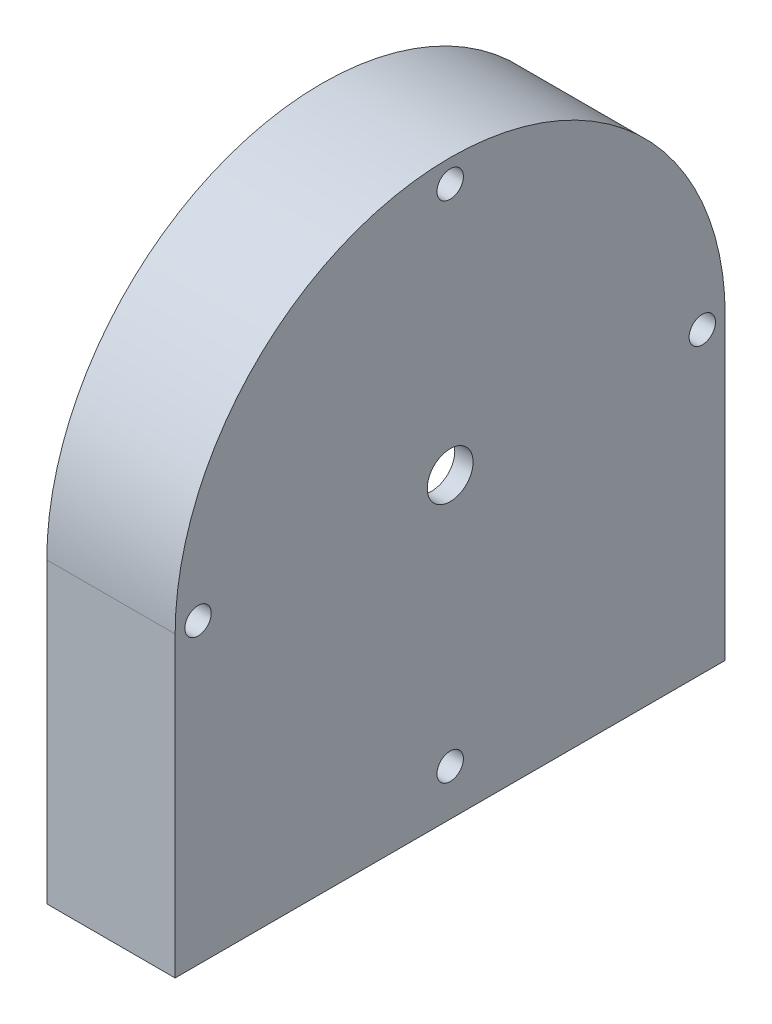
from build123d import *

# Parameters (mm, degrees)
SKETCH1_R                 = 38.1
BOSS_EXTRUDE1_DEPTH       = 17.78
SKETCH2_R                 = 25.4
CUT_EXTRUDE1_DEPTH        = 8.89
F_6_CLEARANCE_HOLE1_D     = 3.6576
SKETCH6_R                 = 14.2875
CUT_EXTRUDE2_DEPTH        = 6.35
SKETCH7_R                 = 3.175
CUT_EXTRUDE3_DEPTH        = 59.918282604
F_6_CLEARANCE_HOLE2_D     = 3.6576
F_6_CLEARANCE_HOLE2_DEPTH = 12.7
F_6_CLEARANCE_HOLE2_TIP   = 1.0988539


with BuildPart() as part:
    # Sketch1 → Boss-Extrude1 (new body)
    with BuildSketch(Plane(origin=(0, 0, 0), x_dir=(0, 0, -1), z_dir=(1, 0, 0))):
        with BuildLine():
            ThreePointArc((38.1, 0), (0, -38.1), (-38.1, 0))
            Line((-38.1, 0), (-38.1, -41.275))
            Line((-38.1, -41.275), (38.1, -41.275))
            Line((38.1, -41.275), (38.1, 0))
        make_face()
        Circle(SKETCH1_R)
    extrude(amount=BOSS_EXTRUDE1_DEPTH)

    # Sketch2 → Cut-Extrude1 (cut)
    with BuildSketch(Plane.ZY):
        Circle(SKETCH2_R)
    extrude(amount=-CUT_EXTRUDE1_DEPTH, mode=Mode.SUBTRACT)

    # #6 Clearance Hole1 (through all)
    with Locations(Plane(origin=(17.78, 0, 0), x_dir=(0, 0, -1), z_dir=(1, 0, 0))):
        with Locations((0, 34.925), (34.925, 0), (0, -34.925), (-34.925, 0)):
            Hole(F_6_CLEARANCE_HOLE1_D / 2)

    # Sketch6 → Cut-Extrude2 (cut)
    with BuildSketch(Plane.ZY.offset(-8.89)):
        Circle(SKETCH6_R)
    extrude(amount=-CUT_EXTRUDE2_DEPTH, mode=Mode.SUBTRACT)

    # Sketch7 → Cut-Extrude3 (cut, through all)
    with BuildSketch(Plane(origin=(17.78, 0, 0), x_dir=(0, 0, -1), z_dir=(1, 0, 0))):
        Circle(SKETCH7_R)
    extrude(amount=-CUT_EXTRUDE3_DEPTH, mode=Mode.SUBTRACT)

    # #6 Clearance Hole2
    with Locations(Plane(origin=(0, -41.275, 0), x_dir=(-1, 0, 0), z_dir=(0, -1, 0))):
        with Locations((-8.89, 25.4), (-8.89, -25.4)):
            Hole(F_6_CLEARANCE_HOLE2_D / 2, depth=F_6_CLEARANCE_HOLE2_DEPTH)
            with Locations((0, 0, -(F_6_CLEARANCE_HOLE2_DEPTH + F_6_CLEARANCE_HOLE2_TIP / 2))):  # 118° drill point
                Cone(0, F_6_CLEARANCE_HOLE2_D / 2, F_6_CLEARANCE_HOLE2_TIP, mode=Mode.SUBTRACT)


solid = part.part
